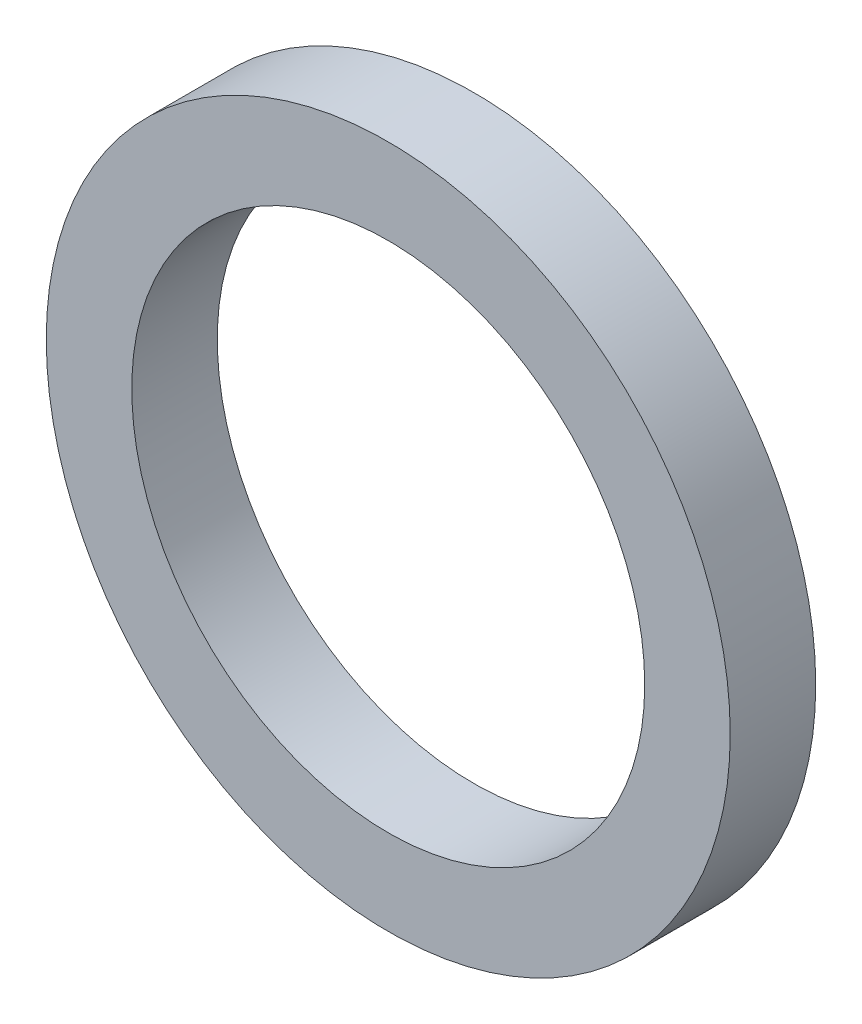
from build123d import *

# Parameters (mm, degrees)
SKETCH1_R           = 50.8
SKETCH1_R_2         = 38.1
BOSS_EXTRUDE1_DEPTH = 6.35


with BuildPart() as part:
    # Sketch1 → Boss-Extrude1 (new, symmetric)
    with BuildSketch(Plane.XY):
        Circle(SKETCH1_R)
        Circle(SKETCH1_R_2, mode=Mode.SUBTRACT)
    extrude(amount=BOSS_EXTRUDE1_DEPTH, both=True)


solid = part.part
